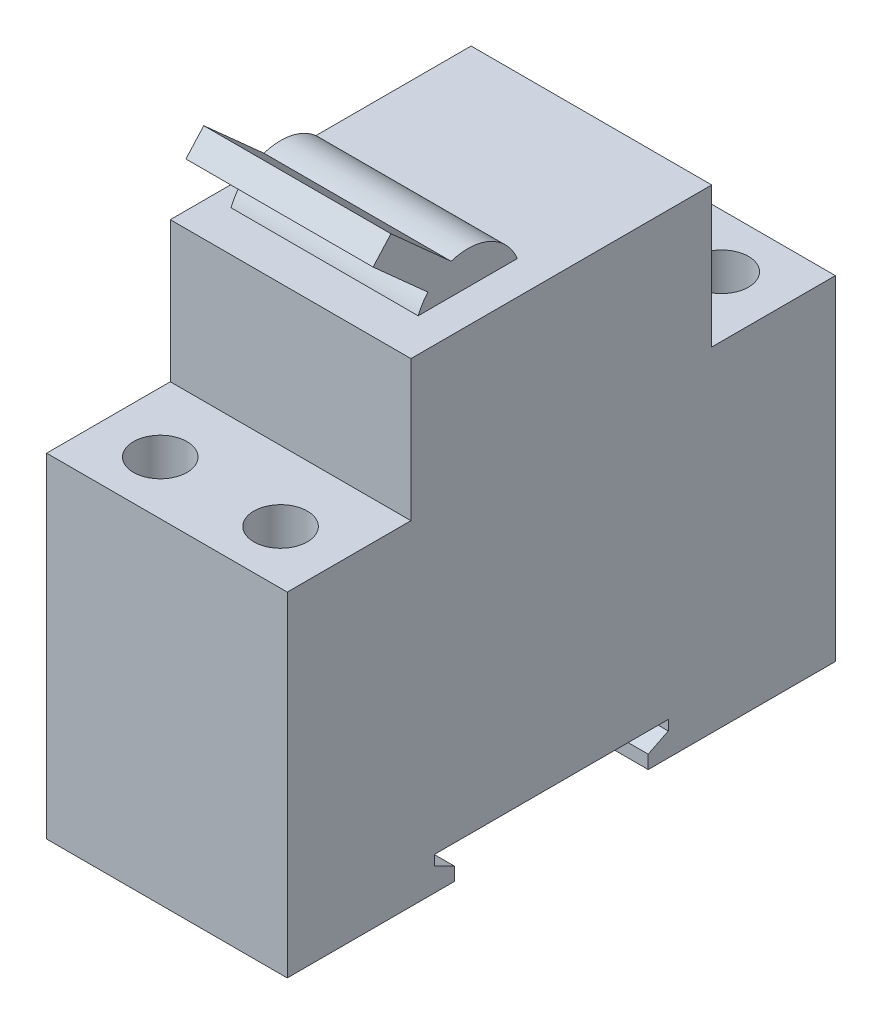
from build123d import *

# Parameters (mm, degrees)
BASE_EXTRUSION_DEPTH    = 36
BOSS_EXTRU_3_DEPTH      = 28
ESQUISSE6_R             = 4
ENL_V_MAT_EXTRU_2_DEPTH = 10


with BuildPart() as part:
    # Esquisse1 → Base-Extrusion (new body)
    with BuildSketch(Plane(origin=(0, 0, 0), x_dir=(0, 0, -1), z_dir=(1, 0, 0))):
        Polygon((0, 0), (0, 50), (18.5, 50), (18.5, 71), (63.5, 71), (63.5, 50), (82, 50), (82, 0), (54, 0), (54, 2), (57, 3.5), (57, 5), (22, 5), (22, 3.5), (25, 2), (25, 0), align=None)
    extrude(amount=BASE_EXTRUSION_DEPTH)

    # Esquisse5 → Boss.-Extru.3 (add)
    with BuildSketch(Plane(origin=(3, 0, 0), x_dir=(0, 0, -1), z_dir=(1, 0, 0))):
        with BuildLine():
            Line((26.042142261, 73.3389073), (17.839623353, 80.689282216))
            Line((17.839623353, 80.689282216), (20.510768328, 83.670098489))
            Line((20.510768328, 83.670098489), (29.512578974, 75.603468724))
            ThreePointArc((29.512578974, 75.603468724), (36.695776389, 74.476857579), (40, 68))
            Line((40, 68), (24, 68))
            ThreePointArc((24, 68), (24.527956708, 70.858070861), (26.042142261, 73.3389073))
        make_face()
    extrude(amount=BOSS_EXTRU_3_DEPTH)

    # Esquisse6 → Enlèv. mat.-Extru.2 (cut)
    with BuildSketch(Plane(origin=(0, 50, 0), x_dir=(-1, 0, 0), z_dir=(0, 1, 0))):
        with Locations(Location((-9, -8, 0), (0, 0, 90))):
            Circle(ESQUISSE6_R)
        with Locations(Location((-27, -8, 0), (0, 0, 90))):
            Circle(ESQUISSE6_R)
        with Locations((-45, -8)):
            Circle(ESQUISSE6_R)
        with Locations((-63, -8)):
            Circle(ESQUISSE6_R)
        with Locations(Location((-9, -74, 0), (0, 0, 90))):
            Circle(ESQUISSE6_R)
        with Locations(Location((-27, -74, 0), (0, 0, 90))):
            Circle(ESQUISSE6_R)
        with Locations((-45, -74)):
            Circle(ESQUISSE6_R)
        with Locations((-63, -74)):
            Circle(ESQUISSE6_R)
    extrude(amount=-ENL_V_MAT_EXTRU_2_DEPTH, mode=Mode.SUBTRACT)


solid = part.part
